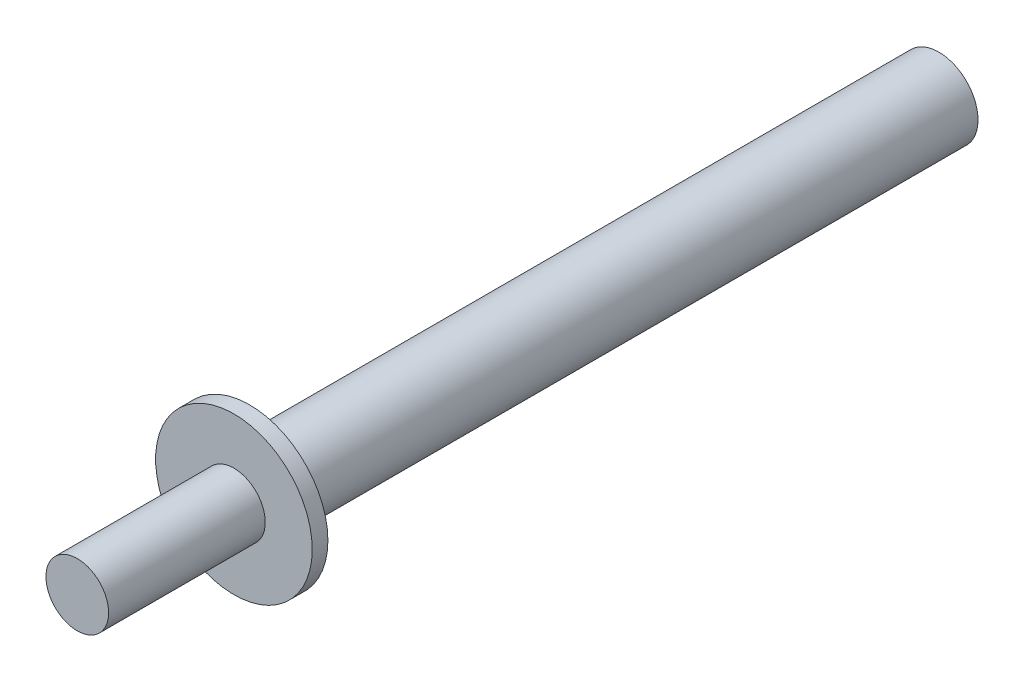
from build123d import *

# Parameters (mm, degrees)
SKETCH1_R           = 1.25
BOSS_EXTRUDE1_DEPTH = 22
SKETCH2_R           = 2.5
BOSS_EXTRUDE2_DEPTH = 0.5
SKETCH3_R           = 1
BOSS_EXTRUDE3_DEPTH = 5


with BuildPart() as part:
    # Sketch1 → Boss-Extrude1 (new body)
    with BuildSketch(Plane.XY):
        Circle(SKETCH1_R)
    extrude(amount=BOSS_EXTRUDE1_DEPTH)

    # Sketch2 → Boss-Extrude2 (add)
    with BuildSketch(Plane.XY.offset(22)):
        Circle(SKETCH2_R)
    extrude(amount=BOSS_EXTRUDE2_DEPTH)

    # Sketch3 → Boss-Extrude3 (add)
    with BuildSketch(Plane.XY.offset(22.5)):
        Circle(SKETCH3_R)
    extrude(amount=BOSS_EXTRUDE3_DEPTH)


solid = part.part
